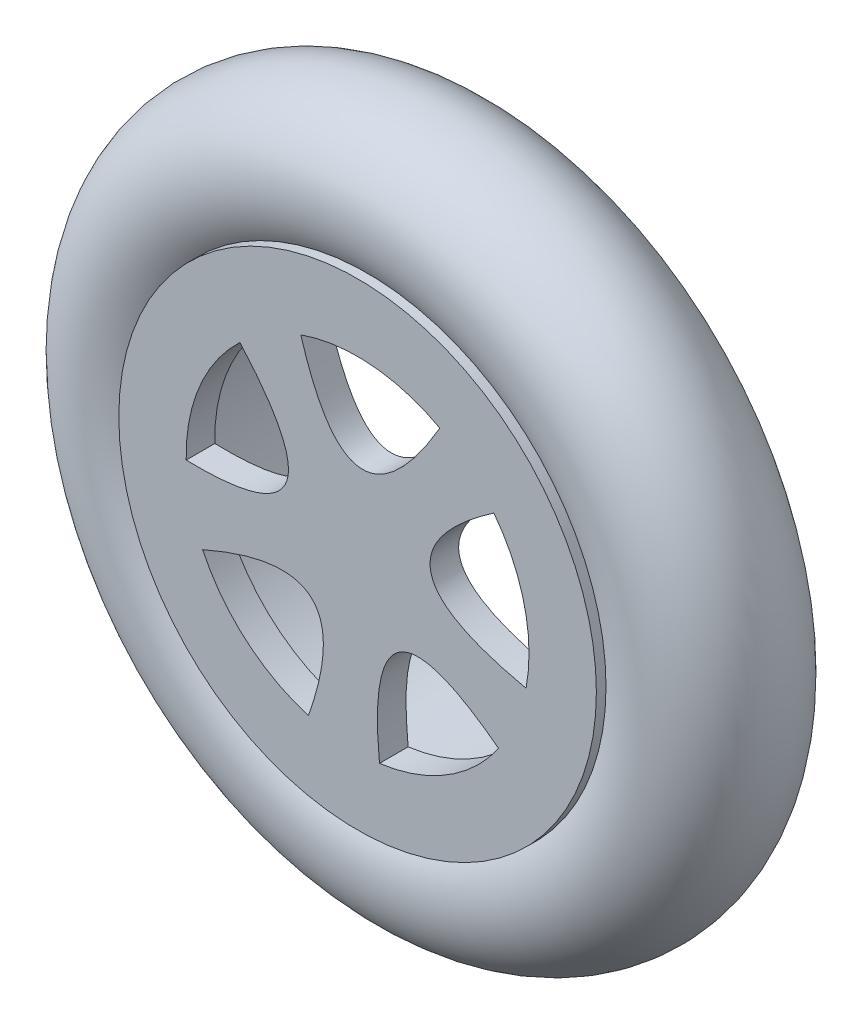
from build123d import *

# Parameters (mm, degrees)
SKETCH1_R      = 123.825
EXTRUDE1_DEPTH = 76.2
SKETCH4_W      = 17.455227324
SKETCH4_H      = 66.2
EXTRUDE7_DEPTH = 191.975656171
SKETCH8_R      = 103.876598788
EXTRUDE8_DEPTH = 61.357082


with BuildPart() as part:
    # Sketch1 → Extrude1 (new body)
    with BuildSketch(Plane.XY):
        with Locations(Location((0, 0, 0), (0, 0, 180))):
            Circle(SKETCH1_R)
    extrude(amount=EXTRUDE1_DEPTH)

    # Sketch4 → Cut-Revolve1 (revolve, cut)
    with BuildSketch(Plane(origin=(0, 0, 0), x_dir=(1, 0, 0), z_dir=(0, 1, 0)), mode=Mode.PRIVATE) as cut_revolve1_sk:
        with Locations((115.097386338, -38.1)):
            Rectangle(SKETCH4_W, SKETCH4_H)
    revolve(cut_revolve1_sk.sketch.rotate(Axis((0, 0, 0), (0, 0, 1)), 180), axis=Axis((0, 0, 0), (0, 0, 1)), mode=Mode.SUBTRACT)

    # Sketch2 → Extrude7 (cut, through all)
    with BuildSketch(Plane(origin=(0, 0, 0), x_dir=(-1, 0, 0), z_dir=(0, 0, -1))):
        with BuildLine():
            add(Edge.make_bspline(
                [(-87.364978695, -16.449027254), (-61.27965147, -10.813441939), (-48.861717362, -2.569537789)],
                knots=[0, 0, 0, 0.288609818, 0.288609818, 0.288609818], degree=2))
            Line((-48.861717362, -2.569537789), (-55.5625, 18.053350622))
            Line((-55.5625, 18.053350622), (-42.187847239, 27.77060465))
            add(Edge.make_bspline(
                [(-42.187847239, 27.77060465), (-49.93088885, 39.603142144), (-70.682590657, 53.918284265)],
                knots=[0.718431192, 0.718431192, 0.718431192, 1, 1, 1], degree=2))
            Line((-70.682590657, 53.918284265), (-86.502301571, 20.507604026))
            Line((-86.502301571, 20.507604026), (-87.364978695, -16.449027254))
        make_face()
        with BuildLine():
            Line((-86.502301571, 20.507604026), (-70.682590657, 53.918284265))
            ThreePointArc((-70.682590657, 53.918284265), (-80.348248112, 38.044303454), (-86.502301571, 20.507604026))
        make_face()
        with BuildLine():
            ThreePointArc((-86.502301571, 20.507604026), (-88.875789367, 2.074623896), (-87.364978695, -16.449027254))
            Line((-87.364978695, -16.449027254), (-86.502301571, 20.507604026))
        make_face()
        with BuildLine():
            add(Edge.make_bspline(
                [(-48.861717362, -2.569537789), (-38.943167303, 4.015098212), (-37.743952233, 12.263753494)],
                knots=[0.288609818, 0.288609818, 0.288609818, 0.519130523, 0.519130523, 0.519130523], degree=2))
            add(Edge.make_bspline(
                [(-37.743952233, 12.263753494), (-36.707150073, 19.395271291), (-42.187847239, 27.77060465)],
                knots=[0.519130523, 0.519130523, 0.519130523, 0.718431192, 0.718431192, 0.718431192], degree=2))
            Line((-42.187847239, 27.77060465), (-55.5625, 18.053350622))
            Line((-55.5625, 18.053350622), (-48.861717362, -2.569537789))
        make_face()
        with BuildLine():
            add(Edge.make_bspline(
                [(-11.353308573, -88.172061246), (-8.652259294, -61.621949174), (-12.655325381, -47.264285539)],
                knots=[0, 0, 0, 0.288609818, 0.288609818, 0.288609818], degree=2))
            Line((-12.655325381, -47.264285539), (-34.3395135, -47.264285539))
            Line((-34.3395135, -47.264285539), (-39.448176267, -31.541438244))
            add(Edge.make_bspline(
                [(-39.448176267, -31.541438244), (-53.094319601, -35.249053252), (-73.121457317, -50.561472287)],
                knots=[0.718431192, 0.718431192, 0.718431192, 1, 1, 1], degree=2))
            Line((-73.121457317, -50.561472287), (-46.234571681, -75.931379426))
            Line((-46.234571681, -75.931379426), (-11.353308573, -88.172061246))
        make_face()
        with BuildLine():
            add(Edge.make_bspline(
                [(-12.655325381, -47.264285539), (-15.852685829, -35.796419447), (-23.32704535, -32.106923477)],
                knots=[0.288609818, 0.288609818, 0.288609818, 0.519130523, 0.519130523, 0.519130523], degree=2))
            add(Edge.make_bspline(
                [(-23.32704535, -32.106923477), (-29.789132335, -28.917105832), (-39.448176267, -31.541438244)],
                knots=[0.519130523, 0.519130523, 0.519130523, 0.718431192, 0.718431192, 0.718431192], degree=2))
            Line((-39.448176267, -31.541438244), (-34.3395135, -47.264285539))
            Line((-34.3395135, -47.264285539), (-12.655325381, -47.264285539))
        make_face()
        with BuildLine():
            Line((-46.234571681, -75.931379426), (-73.121457317, -50.561472287))
            ThreePointArc((-73.121457317, -50.561472287), (-61.011256843, -64.659388633), (-46.234571681, -75.931379426))
        make_face()
        with BuildLine():
            ThreePointArc((-46.234571681, -75.931379426), (-29.437213878, -83.884804578), (-11.353308573, -88.172061246))
            Line((-11.353308573, -88.172061246), (-46.234571681, -75.931379426))
        make_face()
        with BuildLine():
            ThreePointArc((57.927764817, -67.435777324), (70.682590657, -53.918284265), (80.348248112, -38.044303454))
            Line((80.348248112, -38.044303454), (57.927764817, -67.435777324))
        make_face()
        with BuildLine():
            add(Edge.make_bspline(
                [(80.348248112, -38.044303454), (55.932261147, -27.271017104), (41.040296138, -26.641397128)],
                knots=[0, 0, 0, 0.288609818, 0.288609818, 0.288609818], degree=2))
            Line((41.040296138, -26.641397128), (34.3395135, -47.264285539))
            Line((34.3395135, -47.264285539), (17.807533512, -47.264285539))
            add(Edge.make_bspline(
                [(17.807533512, -47.264285539), (17.116794728, -61.388255125), (25.491044728, -85.16699266)],
                knots=[0.718431192, 0.718431192, 0.718431192, 1, 1, 1], degree=2))
            Line((25.491044728, -85.16699266), (57.927764817, -67.435777324))
            Line((57.927764817, -67.435777324), (80.348248112, -38.044303454))
        make_face()
        with BuildLine():
            add(Edge.make_bspline(
                [(41.040296138, -26.641397128), (29.145668647, -26.138502105), (23.32704535, -32.106923477)],
                knots=[0.288609818, 0.288609818, 0.288609818, 0.519130523, 0.519130523, 0.519130523], degree=2))
            add(Edge.make_bspline(
                [(23.32704535, -32.106923477), (18.296453795, -37.267025552), (17.807533512, -47.264285539)],
                knots=[0.519130523, 0.519130523, 0.519130523, 0.718431192, 0.718431192, 0.718431192], degree=2))
            Line((17.807533512, -47.264285539), (34.3395135, -47.264285539))
            Line((34.3395135, -47.264285539), (41.040296138, -26.641397128))
        make_face()
        with BuildLine():
            Line((57.927764817, -67.435777324), (25.491044728, -85.16699266))
            ThreePointArc((25.491044728, -85.16699266), (42.641217687, -78.006003322), (57.927764817, -67.435777324))
        make_face()
        with BuildLine():
            add(Edge.make_bspline(
                [(61.011256843, 64.659388633), (43.220297751, 44.767533696), (38.019623302, 30.798996606)],
                knots=[0, 0, 0, 0.288609818, 0.288609818, 0.288609818], degree=2))
            Line((38.019623302, 30.798996606), (55.5625, 18.053350622))
            Line((55.5625, 18.053350622), (50.453837233, 2.330503327))
            add(Edge.make_bspline(
                [(50.453837233, 2.330503327), (63.673080521, -2.690974925), (88.875789367, -2.074623896)],
                knots=[0.718431192, 0.718431192, 0.718431192, 1, 1, 1], degree=2))
            Line((88.875789367, -2.074623896), (82.03589923, 34.253776982))
            Line((82.03589923, 34.253776982), (61.011256843, 64.659388633))
        make_face()
        with BuildLine():
            add(Edge.make_bspline(
                [(38.019623302, 30.798996606), (33.865699678, 19.641936731), (37.743952233, 12.263753494)],
                knots=[0.288609818, 0.288609818, 0.288609818, 0.519130523, 0.519130523, 0.519130523], degree=2))
            add(Edge.make_bspline(
                [(37.743952233, 12.263753494), (41.096962653, 5.884817381), (50.453837233, 2.330503327)],
                knots=[0.519130523, 0.519130523, 0.519130523, 0.718431192, 0.718431192, 0.718431192], degree=2))
            Line((50.453837233, 2.330503327), (55.5625, 18.053350622))
            Line((55.5625, 18.053350622), (38.019623302, 30.798996606))
        make_face()
        with BuildLine():
            ThreePointArc((82.03589923, 34.253776982), (73.121457317, 50.561472287), (61.011256843, 64.659388633))
            Line((61.011256843, 64.659388633), (82.03589923, 34.253776982))
        make_face()
        with BuildLine():
            Line((82.03589923, 34.253776982), (88.875789367, -2.074623896))
            ThreePointArc((88.875789367, -2.074623896), (88.893947136, -1.037382579), (88.9, 0))
            ThreePointArc((88.9, 0), (87.167085077, 17.467377571), (82.03589923, 34.253776982))
        make_face()
        with BuildLine():
            add(Edge.make_bspline(
                [(-42.641217687, 78.006003322), (-29.220648133, 54.938874521), (-17.542876698, 45.67622385)],
                knots=[0, 0, 0, 0.288609818, 0.288609818, 0.288609818], degree=2))
            Line((-17.542876698, 45.67622385), (0, 58.421869834))
            Line((0, 58.421869834), (13.374652761, 48.704615806))
            add(Edge.make_bspline(
                [(13.374652761, 48.704615806), (22.235333203, 59.725141159), (29.437213878, 83.884804578)],
                knots=[0.718431192, 0.718431192, 0.718431192, 1, 1, 1], degree=2))
            Line((29.437213878, 83.884804578), (-7.226790795, 88.605775742))
            Line((-7.226790795, 88.605775742), (-42.641217687, 78.006003322))
        make_face()
        with BuildLine():
            ThreePointArc((-7.226790795, 88.605775742), (-25.491044728, 85.16699266), (-42.641217687, 78.006003322))
            Line((-42.641217687, 78.006003322), (-7.226790795, 88.605775742))
        make_face()
        with BuildLine():
            add(Edge.make_bspline(
                [(-17.542876698, 45.67622385), (-8.215515194, 38.27788661), (0, 39.686339966)],
                knots=[0.288609818, 0.288609818, 0.288609818, 0.519130523, 0.519130523, 0.519130523], degree=2))
            add(Edge.make_bspline(
                [(0, 39.686339966), (7.102865959, 40.904042711), (13.374652761, 48.704615806)],
                knots=[0.519130523, 0.519130523, 0.519130523, 0.718431192, 0.718431192, 0.718431192], degree=2))
            Line((13.374652761, 48.704615806), (0, 58.421869834))
            Line((0, 58.421869834), (-17.542876698, 45.67622385))
        make_face()
        with BuildLine():
            Line((-7.226790795, 88.605775742), (29.437213878, 83.884804578))
            ThreePointArc((29.437213878, 83.884804578), (11.353308573, 88.172061246), (-7.226790795, 88.605775742))
        make_face()
    extrude(amount=-EXTRUDE7_DEPTH, mode=Mode.SUBTRACT)

    # Sketch5 → Revolve1 (revolve)
    with BuildSketch(Plane(origin=(0, 0, 0), x_dir=(1, 0, 0), z_dir=(0, 1, 0))):
        with BuildLine():
            Line((-123.825, -71.2), (-106.369772676, -71.2))
            Line((-106.369772676, -71.2), (-106.369772676, -5))
            Line((-106.369772676, -5), (-123.825, -5))
            ThreePointArc((-123.825, -5), (-183.480240999, -38.1), (-123.825, -71.2))
        make_face()
    revolve(axis=Axis((0, 0, 0), (0, 0, 1)))

    # Sketch8 → Extrude8 (cut)
    with BuildSketch(Plane(origin=(0, 0, 0), x_dir=(-1, 0, 0), z_dir=(0, 0, -1))):
        Circle(SKETCH8_R)
    extrude(amount=-EXTRUDE8_DEPTH, mode=Mode.SUBTRACT)


solid = part.part
